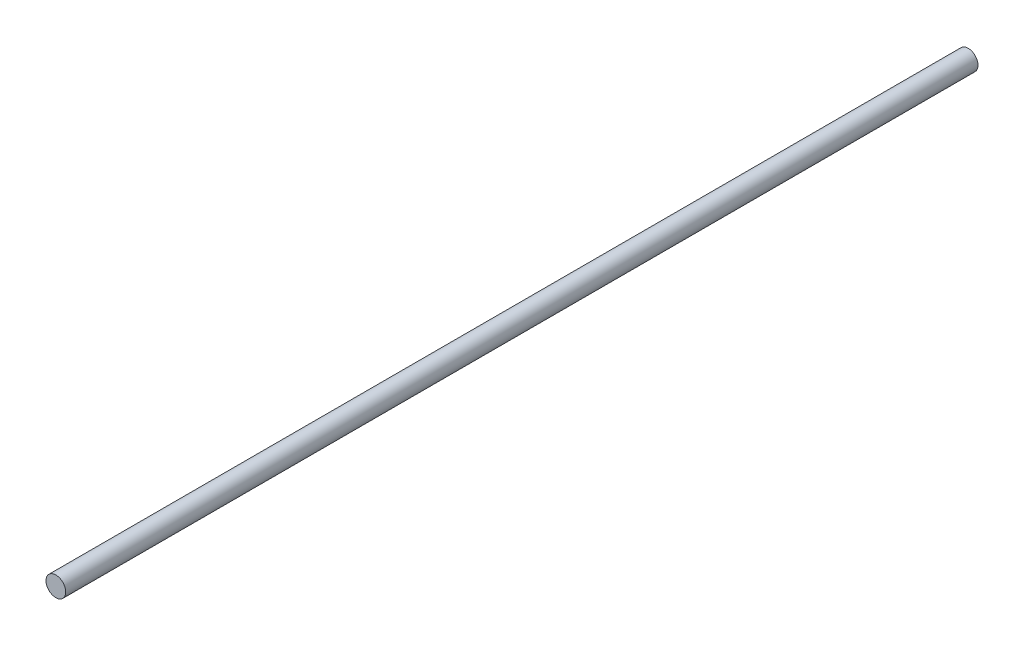
from build123d import *

# Parameters (mm, degrees)
SKETCH_1_R      = 4
EXTRUDE_1_DEPTH = 370


with BuildPart() as part:
    # 草图1 → 凸台-拉伸1 (new body)
    with BuildSketch(Plane.XY):
        Circle(SKETCH_1_R)
    extrude(amount=-EXTRUDE_1_DEPTH)


solid = part.part
